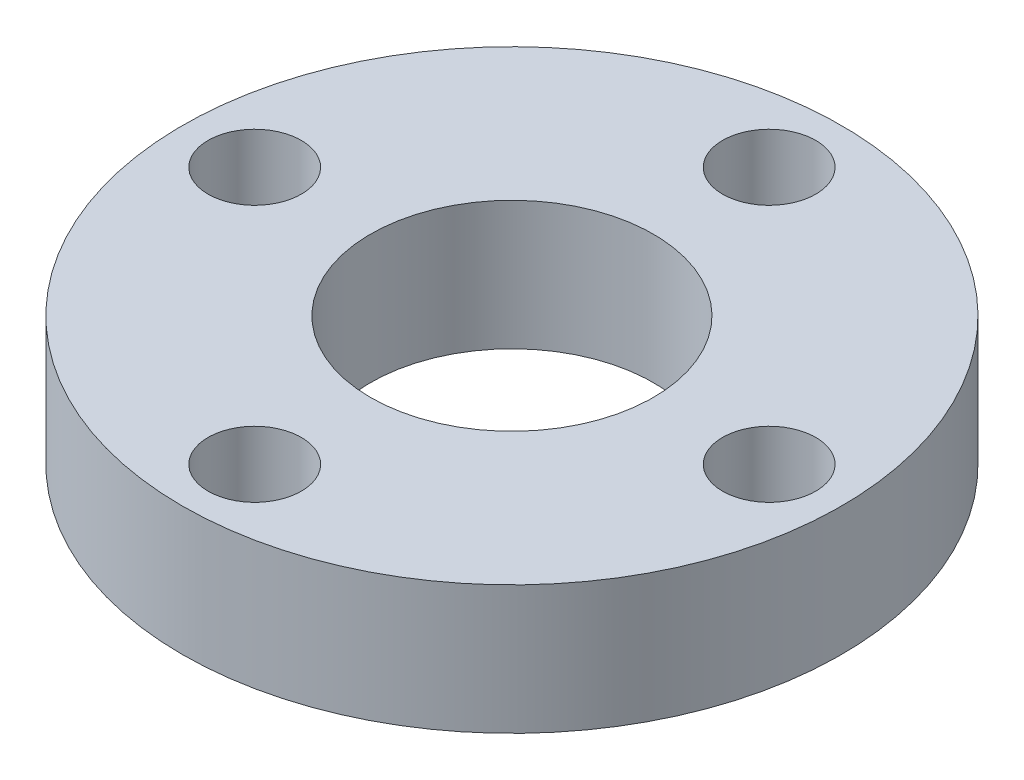
from build123d import *

# Parameters (mm, degrees)
SKETCH1_R           = 10.25
SKETCH1_R_2         = 4.4
SKETCH1_R_3         = 1.45
BOSS_EXTRUDE1_DEPTH = 4


with BuildPart() as part:
    # Sketch1 → Boss-Extrude1 (new body)
    with BuildSketch(Plane(origin=(0, 0, 0), x_dir=(1, 0, 0), z_dir=(0, 1, 0))):
        with Locations(Location((0, 0, 0), (0, 0, 270))):
            Circle(SKETCH1_R)
        with Locations(Location((0, 0, 0), (0, 0, 270))):
            Circle(SKETCH1_R_2, mode=Mode.SUBTRACT)
        with Locations(Location((0, 8, 0), (0, 0, 270))):
            Circle(SKETCH1_R_3, mode=Mode.SUBTRACT)
        with Locations(Location((8, 0, 0), (0, 0, 270))):
            Circle(SKETCH1_R_3, mode=Mode.SUBTRACT)
        with Locations(Location((0, -8, 0), (0, 0, 270))):
            Circle(SKETCH1_R_3, mode=Mode.SUBTRACT)
        with Locations(Location((-8, 0, 0), (0, 0, 270))):
            Circle(SKETCH1_R_3, mode=Mode.SUBTRACT)
    extrude(amount=BOSS_EXTRUDE1_DEPTH)


solid = part.part
